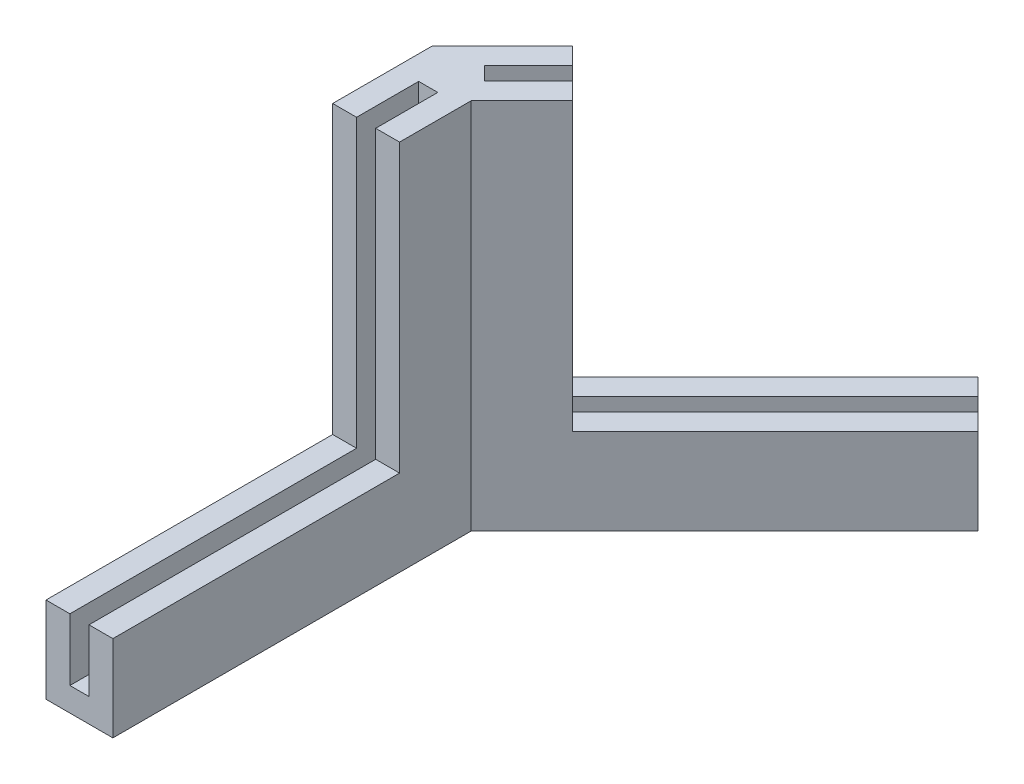
from build123d import *

# Parameters (mm, degrees)
BOSS_EXTRUDE1_DEPTH = 78
SKETCH4_W           = 4
SKETCH4_H           = 5
BOSS_EXTRUDE2_DEPTH = 13
SKETCH5_W           = 4
SKETCH5_H           = 5
BOSS_EXTRUDE3_DEPTH = 13
BOSS_EXTRUDE6_DEPTH = 60


with BuildPart() as part:
    # Sketch2 → Boss-Extrude1 (new body)
    with BuildSketch(Plane(origin=(0, 0, 0), x_dir=(1, 0, 0), z_dir=(0, 1, 0))):
        Polygon((0, 0), (0, -15), (-5, -15), (-5, -2), (-9, -2), (-9, -15), (-14, -15), (-14, 5.798989873), align=None)
    boss_extrude1 = extrude(amount=BOSS_EXTRUDE1_DEPTH)

    # Mirror1: Boss-Extrude1 across plane
    add(boss_extrude1.mirror(Plane(origin=(0, 78, 0), x_dir=(0.9238795325112891, 0, 0.382683432365084), z_dir=(-0.382683432365084, 0, 0.9238795325112892))))

    # Sketch4 → Boss-Extrude2 (add)
    with BuildSketch(Plane(origin=(1.414213562, 0, -1.414213562), x_dir=(-0.7071067811865562, 0, -0.7071067811865389), z_dir=(0.7071067811865389, 0, -0.7071067811865562))):
        with Locations((7, 2.5)):
            Rectangle(SKETCH4_W, SKETCH4_H)
    extrude(amount=BOSS_EXTRUDE2_DEPTH)

    # Sketch5 → Boss-Extrude3 (add)
    with BuildSketch(Plane.XY.offset(2)):
        with Locations((-7, 2.5)):
            Rectangle(SKETCH5_W, SKETCH5_H)
    extrude(amount=BOSS_EXTRUDE3_DEPTH)

    # Sketch14 → Boss-Extrude6 (add)
    with BuildSketch(Plane.XY.offset(15)):
        Polygon((-14, 0), (0, 0), (0, 18), (-5, 18), (-5, 5), (-9, 5), (-9, 18), (-14, 18), align=None)
    boss_extrude6 = extrude(amount=BOSS_EXTRUDE6_DEPTH)

    # Mirror2: Boss-Extrude6 across plane
    add(boss_extrude6.mirror(Plane(origin=(0, 0, 0), x_dir=(0.9238795325112891, 0, 0.3826834323650842), z_dir=(-0.3826834323650841, 0, 0.9238795325112892))))


solid = part.part
